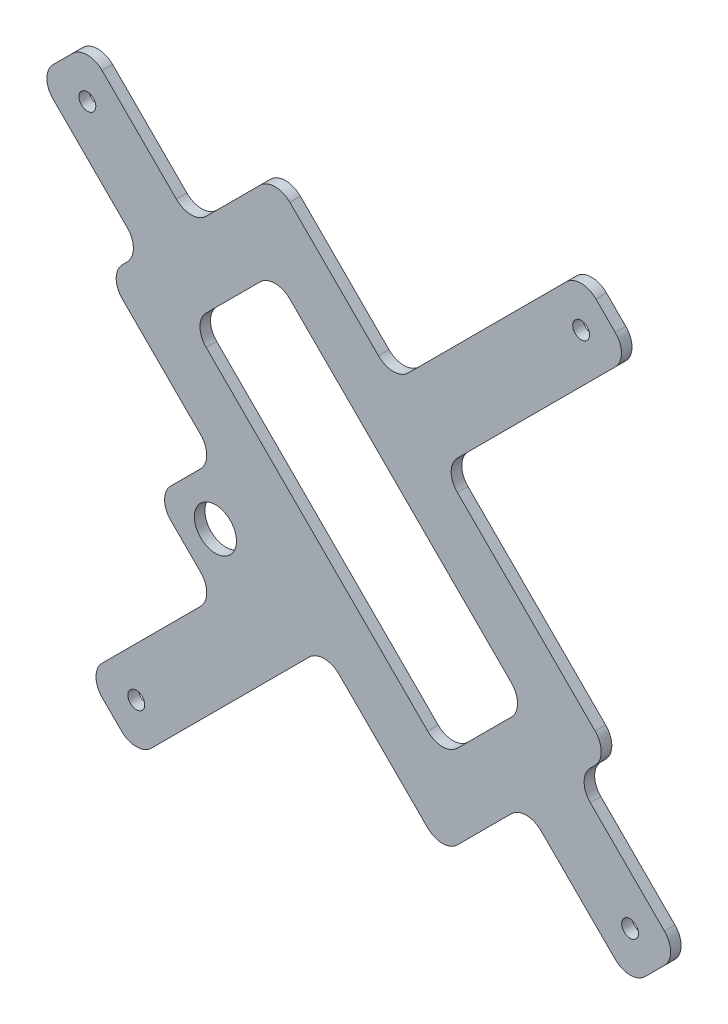
from build123d import *

# Parameters (mm, degrees)
SKETCH2_R           = 1.6
SKETCH2_R_2         = 4
BOSS_EXTRUDE1_DEPTH = 2


with BuildPart() as part:
    # Sketch2 → Boss-Extrude1 (new body)
    with BuildSketch(Plane(origin=(0, 0, 70.507785861), x_dir=(-1, 0, 0), z_dir=(0, 0, -1))):
        with BuildLine():
            Line((-93.581832429, -113.483945735), (-76.752691037, -96.654804343))
            ThreePointArc((-76.752691037, -96.654804343), (-73.924263912, -95.483231467), (-71.095836788, -96.654804343))
            Line((-71.095836788, -96.654804343), (-41.093354786, -126.657286344))
            ThreePointArc((-41.093354786, -126.657286344), (-38.264927661, -127.828859219), (-35.436500537, -126.657286344))
            Line((-35.436500537, -126.657286344), (-31.759545275, -122.980331082))
            ThreePointArc((-31.759545275, -122.980331082), (-30.587972399, -120.151903957), (-31.759545275, -117.323476832))
            Line((-31.759545275, -117.323476832), (-50.448318777, -98.63470333))
            ThreePointArc((-50.448318777, -98.63470333), (-51.619891652, -95.806276205), (-50.448318777, -92.97784908))
            Line((-50.448318777, -92.97784908), (-44.791464528, -87.320994831))
            ThreePointArc((-44.791464528, -87.320994831), (-43.619891652, -84.492567706), (-44.791464528, -81.664140581))
            Line((-44.791464528, -81.664140581), (-50.448318777, -76.007286332))
            ThreePointArc((-50.448318777, -76.007286332), (-51.619891652, -73.178859207), (-50.448318777, -70.350432082))
            Line((-50.448318777, -70.350432082), (-35.599076372, -55.501189677))
            ThreePointArc((-35.599076372, -55.501189677), (-34.427503497, -52.672762553), (-35.599076372, -49.844335428))
            Line((-35.599076372, -49.844335428), (-36.518315188, -48.925096612))
            ThreePointArc((-36.518315188, -48.925096612), (-37.689888063, -46.096669488), (-36.518315188, -43.268242363))
            Line((-36.518315188, -43.268242363), (-22.425735763, -29.175662938))
            ThreePointArc((-22.425735763, -29.175662938), (-21.254162888, -26.347235813), (-22.425735763, -23.518808689))
            Line((-22.425735763, -23.518808689), (-26.102691025, -19.841853427))
            ThreePointArc((-26.102691025, -19.841853427), (-28.93111815, -18.670280551), (-31.759545275, -19.841853427))
            Line((-31.759545275, -19.841853427), (-45.852124699, -33.934432851))
            ThreePointArc((-45.852124699, -33.934432851), (-48.680551824, -35.106005727), (-51.508978949, -33.934432851))
            Line((-51.508978949, -33.934432851), (-61.762027276, -23.681384524))
            ThreePointArc((-61.762027276, -23.681384524), (-64.590454401, -22.509811649), (-67.418881525, -23.681384524))
            Line((-67.418881525, -23.681384524), (-84.248022918, -40.510525916))
            ThreePointArc((-84.248022918, -40.510525916), (-87.076450042, -41.682098792), (-89.904877167, -40.510525916))
            Line((-89.904877167, -40.510525916), (-119.907359169, -10.508043915))
            ThreePointArc((-119.907359169, -10.508043915), (-122.735786293, -9.33647104), (-125.564213418, -10.508043915))
            Line((-125.564213418, -10.508043915), (-129.24116868, -14.184999177))
            ThreePointArc((-129.24116868, -14.184999177), (-130.412741556, -17.013426302), (-129.24116868, -19.841853427))
            Line((-129.24116868, -19.841853427), (-99.238686679, -49.844335428))
            ThreePointArc((-99.238686679, -49.844335428), (-98.067113804, -52.672762553), (-99.238686679, -55.501189677))
            Line((-99.238686679, -55.501189677), (-125.401637583, -81.664140581))
            ThreePointArc((-125.401637583, -81.664140581), (-126.573210458, -84.492567706), (-125.401637583, -87.320994831))
            Line((-125.401637583, -87.320994831), (-124.482398767, -88.240233646))
            ThreePointArc((-124.482398767, -88.240233646), (-123.310825892, -91.068660771), (-124.482398767, -93.897087896))
            Line((-124.482398767, -93.897087896), (-138.574978192, -107.989667321))
            ThreePointArc((-138.574978192, -107.989667321), (-139.746551067, -110.818094445), (-138.574978192, -113.64652157))
            Line((-138.574978192, -113.64652157), (-134.89802293, -117.323476832))
            ThreePointArc((-134.89802293, -117.323476832), (-132.069595805, -118.495049708), (-129.24116868, -117.323476832))
            Line((-129.24116868, -117.323476832), (-115.148589256, -103.230897408))
            ThreePointArc((-115.148589256, -103.230897408), (-112.320162131, -102.059324532), (-109.491735006, -103.230897408))
            Line((-109.491735006, -103.230897408), (-99.238686679, -113.483945735))
            ThreePointArc((-99.238686679, -113.483945735), (-96.410259554, -114.65551861), (-93.581832429, -113.483945735))
        make_face()
        with Locations((-132.055025121, -110.832665129)):
            Circle(SKETCH2_R, mode=Mode.SUBTRACT)
        with Locations((-28.945688834, -26.332665129)):
            Circle(SKETCH2_R, mode=Mode.SUBTRACT)
        with Locations((-122.750356977, -17.027996986)):
            Circle(SKETCH2_R, mode=Mode.SUBTRACT)
        with Locations((-38.250356977, -120.137333273)):
            Circle(SKETCH2_R, mode=Mode.SUBTRACT)
        with Locations((-53.276745902, -84.492567706)):
            Circle(SKETCH2_R_2, mode=Mode.SUBTRACT)
        with BuildLine():
            Line((-109.491735006, -81.664140581), (-67.418881525, -39.591287101))
            ThreePointArc((-67.418881525, -39.591287101), (-64.590454401, -38.419714226), (-61.762027276, -39.591287101))
            Line((-61.762027276, -39.591287101), (-51.508978949, -49.844335428))
            ThreePointArc((-51.508978949, -49.844335428), (-50.337406074, -52.672762553), (-51.508978949, -55.501189677))
            Line((-51.508978949, -55.501189677), (-93.581832429, -97.574043158))
            ThreePointArc((-93.581832429, -97.574043158), (-96.410259554, -98.745616033), (-99.238686679, -97.574043158))
            Line((-99.238686679, -97.574043158), (-109.491735006, -87.320994831))
            ThreePointArc((-109.491735006, -87.320994831), (-110.663307881, -84.492567706), (-109.491735006, -81.664140581))
        make_face(mode=Mode.SUBTRACT)
    extrude(amount=BOSS_EXTRUDE1_DEPTH)


solid = part.part
